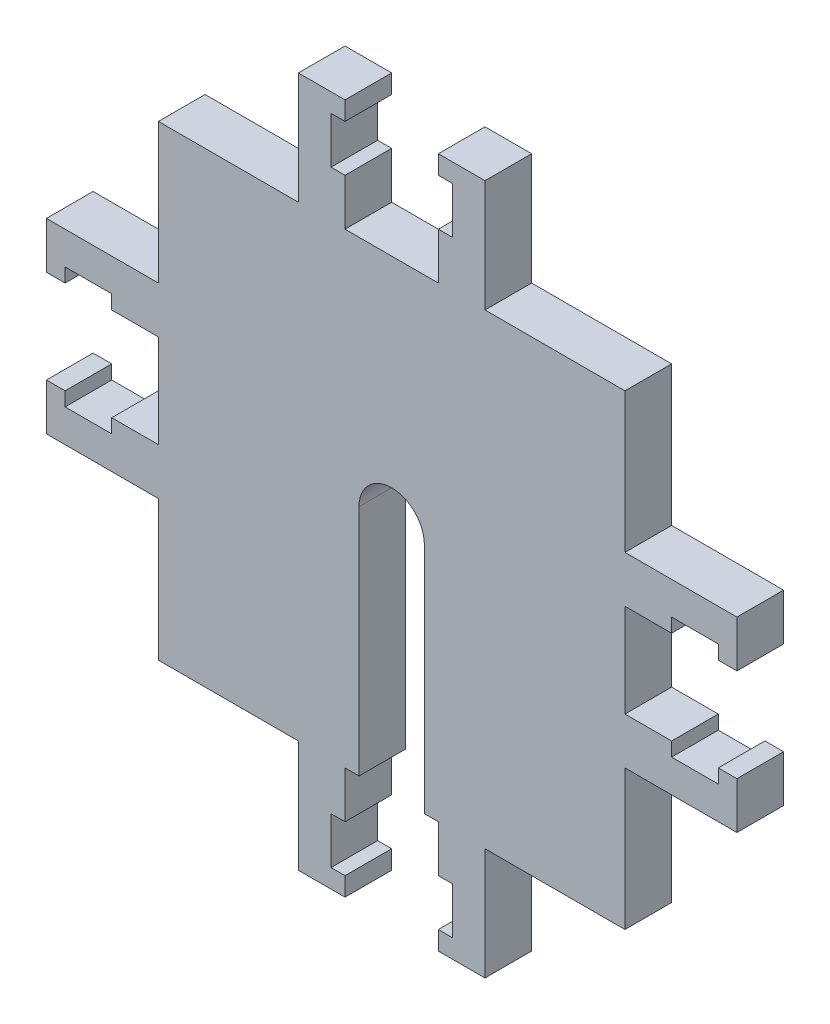
from build123d import *

# Parameters (mm, degrees)
BOSS_EXTRU_1_DEPTH = 5


with BuildPart() as part:
    # Esquisse1 → Boss.-Extru.1 (new body)
    with BuildSketch(Plane.XY):
        with BuildLine():
            Line((-10, 25), (-25, 25))
            Line((-25, 25), (-25, 10))
            Line((-25, 10), (-30, 10))
            Line((-30, 10), (-37, 10))
            Line((-37, 10), (-37, 5))
            Line((-37, 5), (-35, 5))
            Line((-35, 5), (-35, 6.5))
            Line((-35, 6.5), (-30, 6.5))
            Line((-30, 6.5), (-30, 5))
            Line((-30, 5), (-25, 5))
            Line((-25, 5), (-25, 0))
            Line((-25, 0), (-25, -5))
            Line((-25, -5), (-30, -5))
            Line((-30, -5), (-30, -6.5))
            Line((-30, -6.5), (-35, -6.5))
            Line((-35, -6.5), (-35, -5))
            Line((-35, -5), (-37, -5))
            Line((-37, -5), (-37, -10))
            Line((-37, -10), (-30, -10))
            Line((-30, -10), (-25, -10))
            Line((-25, -10), (-25, -25))
            Line((-25, -25), (-10, -25))
            Line((-10, -25), (-10, -30))
            Line((-10, -30), (-10, -37))
            Line((-10, -37), (-5, -37))
            Line((-5, -37), (-5, -35))
            Line((-5, -35), (-6.5, -35))
            Line((-6.5, -35), (-6.5, -30))
            Line((-6.5, -30), (-5, -30))
            Line((-5, -30), (-5, -25))
            Line((-5, -25), (-3.5, -25))
            Line((-3.5, -25), (-3.5, 0))
            ThreePointArc((-3.5, 0), (0, 3.5), (3.5, 0))
            Line((3.5, 0), (3.5, -25))
            Line((3.5, -25), (5, -25))
            Line((5, -25), (5, -30))
            Line((5, -30), (6.5, -30))
            Line((6.5, -30), (6.5, -35))
            Line((6.5, -35), (5, -35))
            Line((5, -35), (5, -37))
            Line((5, -37), (10, -37))
            Line((10, -37), (10, -30))
            Line((10, -30), (10, -25))
            Line((10, -25), (25, -25))
            Line((25, -25), (25, -10))
            Line((25, -10), (30, -10))
            Line((30, -10), (37, -10))
            Line((37, -10), (37, -5))
            Line((37, -5), (35, -5))
            Line((35, -5), (35, -6.5))
            Line((35, -6.5), (30, -6.5))
            Line((30, -6.5), (30, -5))
            Line((30, -5), (25, -5))
            Line((25, -5), (25, 0))
            Line((25, 0), (25, 5))
            Line((25, 5), (30, 5))
            Line((30, 5), (30, 6.5))
            Line((30, 6.5), (35, 6.5))
            Line((35, 6.5), (35, 5))
            Line((35, 5), (37, 5))
            Line((37, 5), (37, 10))
            Line((37, 10), (30, 10))
            Line((30, 10), (25, 10))
            Line((25, 10), (25, 25))
            Line((25, 25), (10, 25))
            Line((10, 25), (10, 30))
            Line((10, 30), (10, 37))
            Line((10, 37), (5, 37))
            Line((5, 37), (5, 35))
            Line((5, 35), (6.5, 35))
            Line((6.5, 35), (6.5, 30))
            Line((6.5, 30), (5, 30))
            Line((5, 30), (5, 25))
            Line((5, 25), (0, 25))
            Line((0, 25), (-5, 25))
            Line((-5, 25), (-5, 30))
            Line((-5, 30), (-6.5, 30))
            Line((-6.5, 30), (-6.5, 35))
            Line((-6.5, 35), (-5, 35))
            Line((-5, 35), (-5, 37))
            Line((-5, 37), (-10, 37))
            Line((-10, 37), (-10, 30))
            Line((-10, 30), (-10, 25))
        make_face()
    extrude(amount=BOSS_EXTRU_1_DEPTH)


solid = part.part
